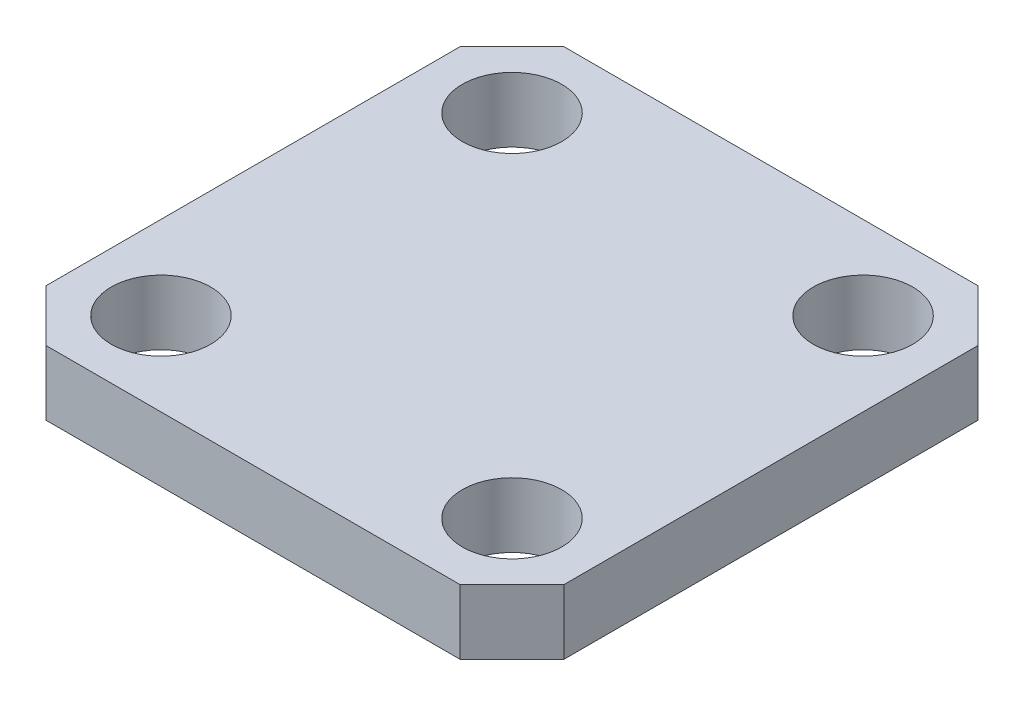
from build123d import *

# Parameters (mm, degrees)
SKETCH1_W             = 12.7
SKETCH1_H             = 12.7
BOSS_EXTRUDE1_DEPTH   = 1.5875
F_2_CLEARANCE_HOLE1_D = 2.4384
CHAMFER1_SIZE         = 1.27


with BuildPart() as part:
    # Sketch1 → Boss-Extrude1 (new body)
    with BuildSketch(Plane(origin=(0, 0, 0), x_dir=(1, 0, 0), z_dir=(0, 1, 0))):
        Rectangle(SKETCH1_W, SKETCH1_H)
    extrude(amount=BOSS_EXTRUDE1_DEPTH)

    # #2 Clearance Hole1 (through all)
    with Locations(Plane(origin=(0, 1.5875, 0), x_dir=(1, 0, 0), z_dir=(0, 1, 0))):
        with Locations((-4.3053, 4.3053), (4.3053, 4.3053), (4.3053, -4.3053), (-4.3053, -4.3053)):
            Hole(F_2_CLEARANCE_HOLE1_D / 2)

    # Chamfer1
    chamfer1_edges = [part.edges().sort_by_distance(p)[0] for p in [
        (6.35, 0.79375, 6.35),
        (-6.35, 0.79375, 6.35),
        (-6.35, 0.79375, -6.35),
        (6.35, 0.79375, -6.35),
    ]]
    chamfer(chamfer1_edges, length=CHAMFER1_SIZE)


solid = part.part
